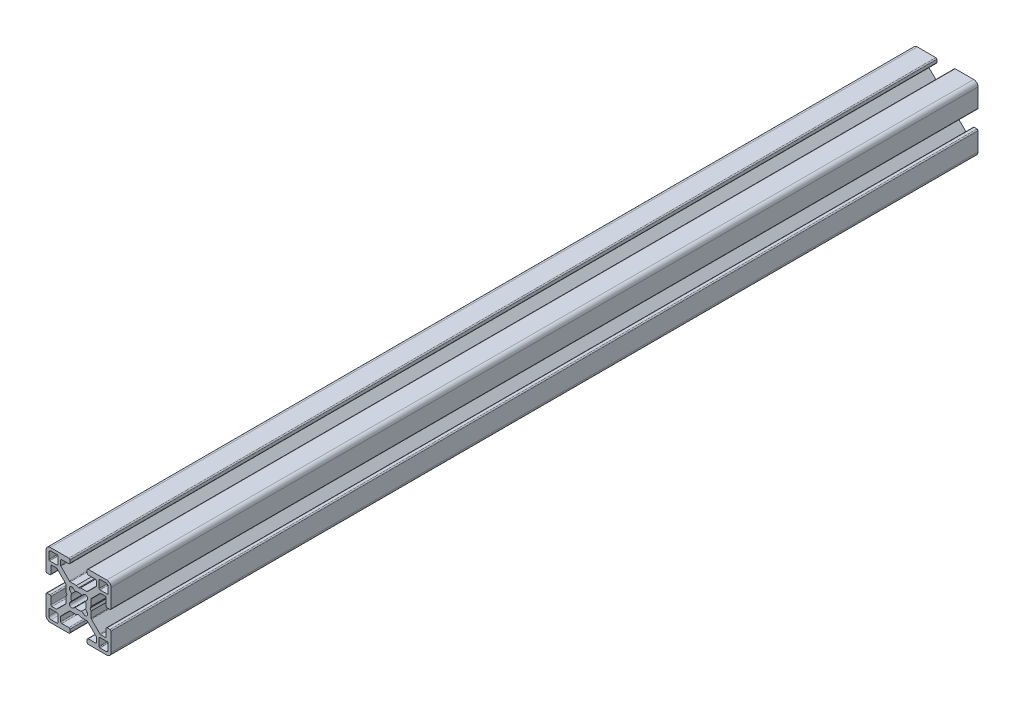
from build123d import *

# Parameters (mm, degrees)
EXTRUDE1_DEPTH = 400


with BuildPart() as part:
    # Sketch1 → Extrude1 (new body)
    with BuildSketch(Plane.XY):
        with BuildLine():
            Line((12.74247465, -4.5), (12.74247465, -7.732519321))
            ThreePointArc((12.74247465, -7.732519321), (12.602449697, -8.097296796), (12.242781236, -8.249967))
            Line((12.242781236, -8.249967), (10.260188032, -8.249967))
            ThreePointArc((10.260188032, -8.249967), (10.068847082, -8.211906919), (9.906636056, -8.103520976))
            Line((9.906636056, -8.103520976), (5.981117769, -4.178002689))
            ThreePointArc((5.981117769, -4.178002689), (5.872731827, -4.015791664), (5.834671745, -3.824450713))
            Line((5.834671745, -3.824450713), (5.834671745, -1.01249595))
            Line((5.834671745, -1.01249595), (5.324673785, -0.06249975))
            Line((5.324673785, -0.06249975), (5.834671745, 0.88749645))
            Line((5.834671745, 0.88749645), (5.834671745, 3.824450713))
            ThreePointArc((5.834671745, 3.824450713), (5.872731827, 4.015791664), (5.981117769, 4.178002689))
            Line((5.981117769, 4.178002689), (9.906636056, 8.103520976))
            ThreePointArc((9.906636056, 8.103520976), (10.068847082, 8.211906919), (10.260188032, 8.249967))
            Line((10.260188032, 8.249967), (12.242781236, 8.249967))
            ThreePointArc((12.242781236, 8.249967), (12.602449697, 8.097296796), (12.74247465, 7.732519321))
            Line((12.74247465, 7.732519321), (12.74247465, 4.5))
            ThreePointArc((12.74247465, 4.5), (12.88892126, 4.146446609), (13.24247465, 4))
            Line((13.24247465, 4), (14.49994, 4))
            ThreePointArc((14.49994, 4), (14.853493391, 4.146446609), (14.99994, 4.5))
            Line((14.99994, 4.5), (14.99994, 12.999948))
            ThreePointArc((14.99994, 12.999948), (14.414155906, 14.414155906), (12.999948, 14.99994))
            Line((12.999948, 14.99994), (4.5, 14.99994))
            ThreePointArc((4.5, 14.99994), (4.146446609, 14.853493391), (4, 14.49994))
            Line((4, 14.49994), (4, 13.24247465))
            ThreePointArc((4, 13.24247465), (4.146446609, 12.88892126), (4.5, 12.74247465))
            Line((4.5, 12.74247465), (7.732519321, 12.74247465))
            ThreePointArc((7.732519321, 12.74247465), (8.097296796, 12.602449697), (8.249967, 12.242781236))
            Line((8.249967, 12.242781236), (8.249967, 10.260188032))
            ThreePointArc((8.249967, 10.260188032), (8.211906919, 10.068847082), (8.103520976, 9.906636056))
            Line((8.103520976, 9.906636056), (4.178002689, 5.981117769))
            ThreePointArc((4.178002689, 5.981117769), (4.015791664, 5.872731827), (3.824450713, 5.834671745))
            Line((3.824450713, 5.834671745), (0.9499962, 5.834671745))
            Line((0.9499962, 5.834671745), (0, 5.324673785))
            Line((0, 5.324673785), (-0.9499962, 5.834671745))
            Line((-0.9499962, 5.834671745), (-3.824450713, 5.834671745))
            ThreePointArc((-3.824450713, 5.834671745), (-4.015791664, 5.872731827), (-4.178002689, 5.981117769))
            Line((-4.178002689, 5.981117769), (-8.103520976, 9.906636056))
            ThreePointArc((-8.103520976, 9.906636056), (-8.211906919, 10.068847082), (-8.249967, 10.260188032))
            Line((-8.249967, 10.260188032), (-8.249967, 12.242781236))
            ThreePointArc((-8.249967, 12.242781236), (-8.097296796, 12.602449697), (-7.732519321, 12.74247465))
            Line((-7.732519321, 12.74247465), (-4.5, 12.74247465))
            ThreePointArc((-4.5, 12.74247465), (-4.146446609, 12.88892126), (-4, 13.24247465))
            Line((-4, 13.24247465), (-4, 14.49994))
            ThreePointArc((-4, 14.49994), (-4.146446609, 14.853493391), (-4.5, 14.99994))
            Line((-4.5, 14.99994), (-12.999948, 14.99994))
            ThreePointArc((-12.999948, 14.99994), (-14.414155906, 14.414155906), (-14.99994, 12.999948))
            Line((-14.99994, 12.999948), (-14.99994, 4.5))
            ThreePointArc((-14.99994, 4.5), (-14.853493391, 4.146446609), (-14.49994, 4))
            Line((-14.49994, 4), (-13.24247465, 4))
            ThreePointArc((-13.24247465, 4), (-12.88892126, 4.146446609), (-12.74247465, 4.5))
            Line((-12.74247465, 4.5), (-12.74247465, 7.732519321))
            ThreePointArc((-12.74247465, 7.732519321), (-12.602449697, 8.097296796), (-12.242781236, 8.249967))
            Line((-12.242781236, 8.249967), (-10.260188032, 8.249967))
            ThreePointArc((-10.260188032, 8.249967), (-10.068847082, 8.211906919), (-9.906636056, 8.103520976))
            Line((-9.906636056, 8.103520976), (-5.981117769, 4.178002689))
            ThreePointArc((-5.981117769, 4.178002689), (-5.872731827, 4.015791664), (-5.834671745, 3.824450713))
            Line((-5.834671745, 3.824450713), (-5.834671745, 0.88749645))
            Line((-5.834671745, 0.88749645), (-5.324673785, -0.06249975))
            Line((-5.324673785, -0.06249975), (-5.834671745, -1.01249595))
            Line((-5.834671745, -1.01249595), (-5.834671745, -3.824450713))
            ThreePointArc((-5.834671745, -3.824450713), (-5.872731827, -4.015791664), (-5.981117769, -4.178002689))
            Line((-5.981117769, -4.178002689), (-9.906636056, -8.103520976))
            ThreePointArc((-9.906636056, -8.103520976), (-10.068847082, -8.211906919), (-10.260188032, -8.249967))
            Line((-10.260188032, -8.249967), (-12.242781236, -8.249967))
            ThreePointArc((-12.242781236, -8.249967), (-12.602449697, -8.097296796), (-12.74247465, -7.732519321))
            Line((-12.74247465, -7.732519321), (-12.74247465, -4.5))
            ThreePointArc((-12.74247465, -4.5), (-12.88892126, -4.146446609), (-13.24247465, -4))
            Line((-13.24247465, -4), (-14.49994, -4))
            ThreePointArc((-14.49994, -4), (-14.853493391, -4.146446609), (-14.99994, -4.5))
            Line((-14.99994, -4.5), (-14.99994, -12.999948))
            ThreePointArc((-14.99994, -12.999948), (-14.414155906, -14.414155906), (-12.999948, -14.99994))
            Line((-12.999948, -14.99994), (-4.5, -14.99994))
            ThreePointArc((-4.5, -14.99994), (-4.146446609, -14.853493391), (-4, -14.49994))
            Line((-4, -14.49994), (-4, -13.24247465))
            ThreePointArc((-4, -13.24247465), (-4.146446609, -12.88892126), (-4.5, -12.74247465))
            Line((-4.5, -12.74247465), (-7.732519321, -12.74247465))
            ThreePointArc((-7.732519321, -12.74247465), (-8.097296796, -12.602449697), (-8.249967, -12.242781236))
            Line((-8.249967, -12.242781236), (-8.249967, -10.260188032))
            ThreePointArc((-8.249967, -10.260188032), (-8.211906919, -10.068847082), (-8.103520976, -9.906636056))
            Line((-8.103520976, -9.906636056), (-4.178002689, -5.981117769))
            ThreePointArc((-4.178002689, -5.981117769), (-4.015791664, -5.872731827), (-3.824450713, -5.834671745))
            Line((-3.824450713, -5.834671745), (-0.9499962, -5.834671745))
            Line((-0.9499962, -5.834671745), (0, -5.324673785))
            Line((0, -5.324673785), (0.9499962, -5.834671745))
            Line((0.9499962, -5.834671745), (3.824450713, -5.834671745))
            ThreePointArc((3.824450713, -5.834671745), (4.015791664, -5.872731827), (4.178002689, -5.981117769))
            Line((4.178002689, -5.981117769), (8.103520976, -9.906636056))
            ThreePointArc((8.103520976, -9.906636056), (8.211906919, -10.068847082), (8.249967, -10.260188032))
            Line((8.249967, -10.260188032), (8.249967, -12.242781236))
            ThreePointArc((8.249967, -12.242781236), (8.097296796, -12.602449697), (7.732519321, -12.74247465))
            Line((7.732519321, -12.74247465), (4.5, -12.74247465))
            ThreePointArc((4.5, -12.74247465), (4.146446609, -12.88892126), (4, -13.24247465))
            Line((4, -13.24247465), (4, -14.49994))
            ThreePointArc((4, -14.49994), (4.146446609, -14.853493391), (4.5, -14.99994))
            Line((4.5, -14.99994), (12.999948, -14.99994))
            ThreePointArc((12.999948, -14.99994), (14.414155906, -14.414155906), (14.99994, -12.999948))
            Line((14.99994, -12.999948), (14.99994, -4.5))
            ThreePointArc((14.99994, -4.5), (14.853493391, -4.146446609), (14.49994, -4))
            Line((14.49994, -4), (13.24247465, -4))
            ThreePointArc((13.24247465, -4), (12.88892126, -4.146446609), (12.74247465, -4.5))
        make_face()
        with BuildLine():
            Line((9.499962, -13.318946724), (9.499962, -9.87996048))
            ThreePointArc((9.499962, -9.87996048), (9.611260978, -9.611260978), (9.87996048, -9.499962))
            Line((9.87996048, -9.499962), (13.318946724, -9.499962))
            ThreePointArc((13.318946724, -9.499962), (13.58835333, -9.61155387), (13.6999452, -9.880960476))
            Line((13.6999452, -9.880960476), (13.6999452, -12.6999492))
            ThreePointArc((13.6999452, -12.6999492), (13.407053153, -13.407053153), (12.6999492, -13.6999452))
            Line((12.6999492, -13.6999452), (9.880960476, -13.6999452))
            ThreePointArc((9.880960476, -13.6999452), (9.61155387, -13.58835333), (9.499962, -13.318946724))
        make_face(mode=Mode.SUBTRACT)
        with BuildLine():
            Line((-13.318946724, -9.499962), (-9.87996048, -9.499962))
            ThreePointArc((-9.87996048, -9.499962), (-9.611260978, -9.611260978), (-9.499962, -9.87996048))
            Line((-9.499962, -9.87996048), (-9.499962, -13.318946724))
            ThreePointArc((-9.499962, -13.318946724), (-9.61155387, -13.58835333), (-9.880960476, -13.6999452))
            Line((-9.880960476, -13.6999452), (-12.6999492, -13.6999452))
            ThreePointArc((-12.6999492, -13.6999452), (-13.407053153, -13.407053153), (-13.6999452, -12.6999492))
            Line((-13.6999452, -12.6999492), (-13.6999452, -9.880960476))
            ThreePointArc((-13.6999452, -9.880960476), (-13.58835333, -9.61155387), (-13.318946724, -9.499962))
        make_face(mode=Mode.SUBTRACT)
        with BuildLine():
            Line((-1.494225248, -3.198138712), (-2.473341823, -3.979927146))
            ThreePointArc((-2.473341823, -3.979927146), (-3.900227701, -3.900227701), (-3.979927146, -2.473341823))
            Line((-3.979927146, -2.473341823), (-3.198138712, -1.494225248))
            ThreePointArc((-3.198138712, -1.494225248), (-3.52998588, 0), (-3.198138712, 1.494225248))
            Line((-3.198138712, 1.494225248), (-3.979927146, 2.473341823))
            ThreePointArc((-3.979927146, 2.473341823), (-3.900227701, 3.900227701), (-2.473341823, 3.979927146))
            Line((-2.473341823, 3.979927146), (-1.494225248, 3.198138712))
            ThreePointArc((-1.494225248, 3.198138712), (0, 3.52998588), (1.494225248, 3.198138712))
            Line((1.494225248, 3.198138712), (2.473341823, 3.979927146))
            ThreePointArc((2.473341823, 3.979927146), (3.900227701, 3.900227701), (3.979927146, 2.473341823))
            Line((3.979927146, 2.473341823), (3.198138712, 1.494225248))
            ThreePointArc((3.198138712, 1.494225248), (3.52998588, 0), (3.198138712, -1.494225248))
            Line((3.198138712, -1.494225248), (3.979927146, -2.473341823))
            ThreePointArc((3.979927146, -2.473341823), (3.900227701, -3.900227701), (2.473341823, -3.979927146))
            Line((2.473341823, -3.979927146), (1.494225248, -3.198138712))
            ThreePointArc((1.494225248, -3.198138712), (0, -3.52998588), (-1.494225248, -3.198138712))
        make_face(mode=Mode.SUBTRACT)
        with BuildLine():
            Line((-9.499962, 13.318946724), (-9.499962, 9.87996048))
            ThreePointArc((-9.499962, 9.87996048), (-9.611260978, 9.611260978), (-9.87996048, 9.499962))
            Line((-9.87996048, 9.499962), (-13.318946724, 9.499962))
            ThreePointArc((-13.318946724, 9.499962), (-13.58835333, 9.61155387), (-13.6999452, 9.880960476))
            Line((-13.6999452, 9.880960476), (-13.6999452, 12.6999492))
            ThreePointArc((-13.6999452, 12.6999492), (-13.407053153, 13.407053153), (-12.6999492, 13.6999452))
            Line((-12.6999492, 13.6999452), (-9.880960476, 13.6999452))
            ThreePointArc((-9.880960476, 13.6999452), (-9.61155387, 13.58835333), (-9.499962, 13.318946724))
        make_face(mode=Mode.SUBTRACT)
        with BuildLine():
            Line((9.880960476, 13.6999452), (12.6999492, 13.6999452))
            ThreePointArc((12.6999492, 13.6999452), (13.407053153, 13.407053153), (13.6999452, 12.6999492))
            Line((13.6999452, 12.6999492), (13.6999452, 9.880960476))
            ThreePointArc((13.6999452, 9.880960476), (13.58835333, 9.61155387), (13.318946724, 9.499962))
            Line((13.318946724, 9.499962), (9.87996048, 9.499962))
            ThreePointArc((9.87996048, 9.499962), (9.611260978, 9.611260978), (9.499962, 9.87996048))
            Line((9.499962, 9.87996048), (9.499962, 13.318946724))
            ThreePointArc((9.499962, 13.318946724), (9.61155387, 13.58835333), (9.880960476, 13.6999452))
        make_face(mode=Mode.SUBTRACT)
    extrude(amount=-EXTRUDE1_DEPTH)


solid = part.part
